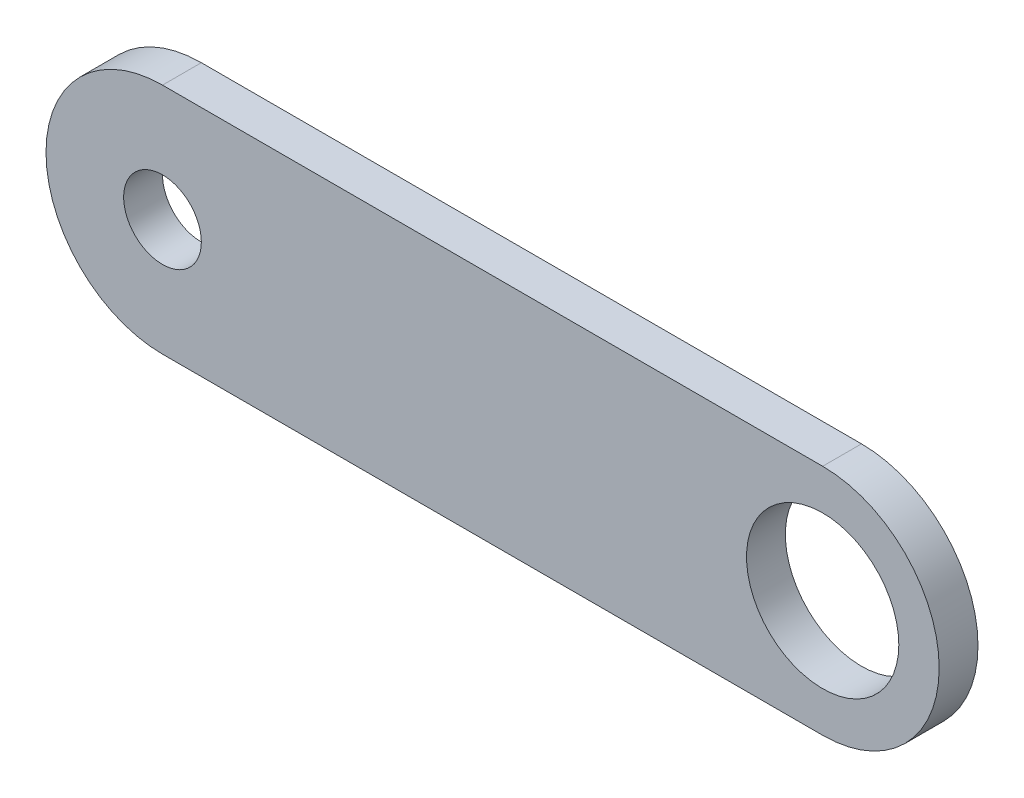
from build123d import *

# Parameters (mm, degrees)
CROQUIS1_R              = 1.960669142
CROQUIS1_R_2            = 1
SALIENTE_EXTRUIR1_DEPTH = 1


with BuildPart() as part:
    # Croquis1 → Saliente-Extruir1 (new body)
    with BuildSketch(Plane.XY):
        with BuildLine():
            Line((-8.5, 3), (8.5, 3))
            ThreePointArc((8.5, 3), (11.5, 0), (8.5, -3))
            Line((8.5, -3), (-8.5, -3))
            ThreePointArc((-8.5, -3), (-11.5, 0), (-8.5, 3))
        make_face()
        with Locations((8.5, 0)):
            Circle(CROQUIS1_R, mode=Mode.SUBTRACT)
        with Locations((-8.5, 0)):
            Circle(CROQUIS1_R_2, mode=Mode.SUBTRACT)
    extrude(amount=SALIENTE_EXTRUIR1_DEPTH)


solid = part.part
